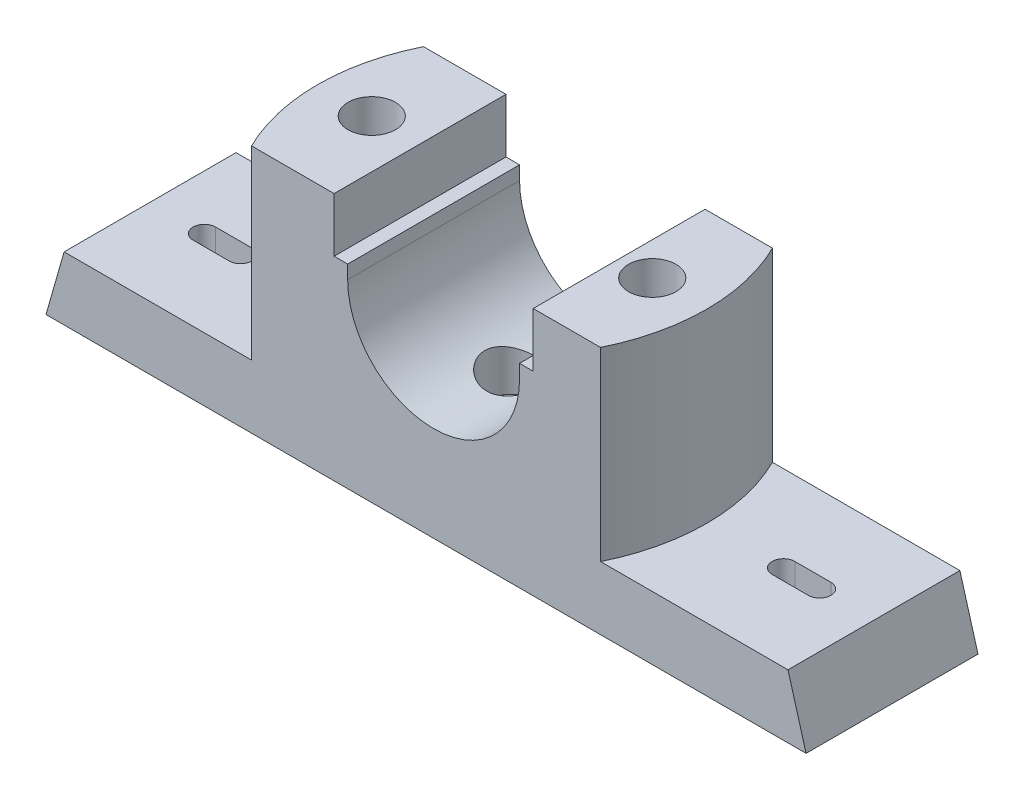
from build123d import *

# Parameters (mm, degrees)
BOSS_EXTRUDE1_DEPTH = 19
CUT_EXTRUDE2_DEPTH  = 2
BOSS_EXTRUDE2_DEPTH = 41
CUT_EXTRUDE3_DEPTH  = 62
SKETCH6_R           = 5.25
CUT_EXTRUDE4_DEPTH  = 72
SKETCH7_R           = 10
CUT_EXTRUDE5_DEPTH  = 9
SKETCH8_R           = 6
CUT_EXTRUDE6_DEPTH  = 42


with BuildPart() as part:
    # Sketch2 → Boss-Extrude1 (new, symmetric)
    with BuildSketch(Plane.XY):
        Polygon((-84, 0), (0, 0), (84, 0), (80, 14), (-80, 14), align=None)
    extrude(amount=BOSS_EXTRUDE1_DEPTH, both=True)

    # Sketch3 → Cut-Extrude2 (cut)
    with BuildSketch(Plane.XZ):
        Polygon((-76, 11), (-76, 0), (-76, -11), (-8, -11), (-8, 11), align=None)
        Polygon((76, 0), (76, -11), (8, -11), (8, 11), (76, 11), align=None)
    extrude(amount=-CUT_EXTRUDE2_DEPTH, mode=Mode.SUBTRACT)

    # Sketch4 → Boss-Extrude2 (add)
    with BuildSketch(Plane(origin=(0, 14, 0), x_dir=(1, 0, 0), z_dir=(0, 1, 0))):
        with BuildLine():
            Line((-38.574603044, 19), (38.574603044, 19))
            ThreePointArc((38.574603044, 19), (43, 0), (38.574603044, -19))
            Line((38.574603044, -19), (-38.574603044, -19))
            ThreePointArc((-38.574603044, -19), (-43, 0), (-38.574603044, 19))
        make_face()
    extrude(amount=BOSS_EXTRUDE2_DEPTH)

    # Sketch5 → Cut-Extrude3 (cut)
    with BuildSketch(Plane.XY.offset(19)):
        with BuildLine():
            Line((20.674705774, 39.999892181), (20.674705774, 43))
            Line((20.674705774, 43), (23.674705774, 43))
            Line((23.674705774, 43), (23.674705774, 55))
            Line((23.674705774, 55), (-20.325294226, 55))
            Line((-20.325294226, 55), (-20.325294226, 43))
            Line((-20.325294226, 43), (-17.325294226, 43))
            Line((-17.325294226, 43), (-17.325294226, 39.999892181))
            ThreePointArc((-17.325294226, 39.999892181), (1.674705774, 20.999892181), (20.674705774, 39.999892181))
        make_face()
    extrude(amount=-CUT_EXTRUDE3_DEPTH, mode=Mode.SUBTRACT)

    # Sketch6 → Cut-Extrude4 (cut)
    with BuildSketch(Plane.XZ):
        with Locations((-31, 0)):
            Circle(SKETCH6_R)
        with Locations(Location((31, 0, 0), (0, 0, 90))):
            Circle(SKETCH6_R)
        with BuildLine():
            Line((68, 2.5), (60, 2.5))
            ThreePointArc((60, 2.5), (57.5, 0), (60, -2.5))
            Line((60, -2.5), (68, -2.5))
            ThreePointArc((68, -2.5), (70.5, 0), (68, 2.5))
        make_face()
        with BuildLine():
            Line((-68, 2.5), (-60, 2.5))
            ThreePointArc((-60, 2.5), (-57.5, 0), (-60, -2.5))
            Line((-60, -2.5), (-68, -2.5))
            ThreePointArc((-68, -2.5), (-70.5, 0), (-68, 2.5))
        make_face()
    extrude(amount=-CUT_EXTRUDE4_DEPTH, mode=Mode.SUBTRACT)

    # Sketch7 → Cut-Extrude5 (cut)
    with BuildSketch(Plane.XZ):
        with Locations((-31, 0)):
            Circle(SKETCH7_R)
        with Locations((31, 0)):
            Circle(SKETCH7_R)
    extrude(amount=-CUT_EXTRUDE5_DEPTH, mode=Mode.SUBTRACT)

    # Sketch8 → Cut-Extrude6 (cut)
    with BuildSketch(Plane(origin=(0, 55, 0), x_dir=(1, 0, 0), z_dir=(0, 1, 0))):
        with Locations(Location((0, 0, 0), (0, 0, 270))):
            Circle(SKETCH8_R)
    extrude(amount=-CUT_EXTRUDE6_DEPTH, mode=Mode.SUBTRACT)


solid = part.part
